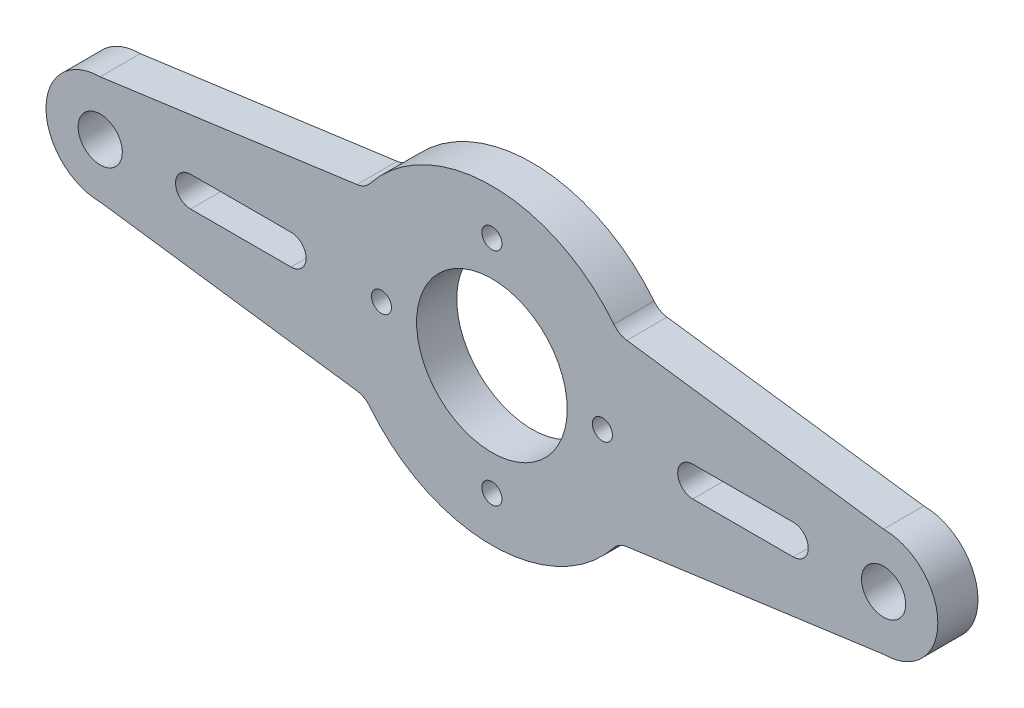
from build123d import *

# Parameters (mm, degrees)
SKETCH1_R             = 1.1
SKETCH1_R_2           = 3.75
BOSS_EXTRUDE1_DEPTH   = 2
F_1_0MM_DOWEL_HOLE1_D = 1
FILLET1_R             = 1


with BuildPart() as part:
    # Sketch1 → Boss-Extrude1 (new body)
    with BuildSketch(Plane.XY):
        with BuildLine():
            Line((-19.5, 2.7), (-6.306155873, 4.504985917))
            ThreePointArc((-6.306155873, 4.504985917), (0, 7.75), (6.306155873, 4.504985917))
            Line((6.306155873, 4.504985917), (19.5, 2.7))
            ThreePointArc((19.5, 2.7), (22.2, 0), (19.5, -2.7))
            Line((19.5, -2.7), (6.306155873, -4.504985917))
            ThreePointArc((6.306155873, -4.504985917), (0, -7.75), (-6.306155873, -4.504985917))
            Line((-6.306155873, -4.504985917), (-19.5, -2.7))
            ThreePointArc((-19.5, -2.7), (-22.2, 0), (-19.5, 2.7))
        make_face()
        with Locations((-19.5, 0)):
            Circle(SKETCH1_R, mode=Mode.SUBTRACT)
        with Locations(Location((19.5, 0, 0), (0, 0, 180))):
            Circle(SKETCH1_R, mode=Mode.SUBTRACT)
        Circle(SKETCH1_R_2, mode=Mode.SUBTRACT)
        with BuildLine():
            Line((-10, -0.75), (-15, -0.75))
            ThreePointArc((-15, -0.75), (-15.75, 0), (-15, 0.75))
            Line((-15, 0.75), (-10, 0.75))
            ThreePointArc((-10, 0.75), (-9.25, 0), (-10, -0.75))
        make_face(mode=Mode.SUBTRACT)
        with BuildLine():
            Line((10, -0.75), (15, -0.75))
            ThreePointArc((15, -0.75), (15.75, 0), (15, 0.75))
            Line((15, 0.75), (10, 0.75))
            ThreePointArc((10, 0.75), (9.25, 0), (10, -0.75))
        make_face(mode=Mode.SUBTRACT)
    extrude(amount=BOSS_EXTRUDE1_DEPTH)

    # Ø1.0mm Dowel Hole1 (through all)
    with Locations(Plane.XY.offset(2)):
        with Locations((-5.5, 0), (0, 5.5), (5.5, 0), (0, -5.5)):
            Hole(F_1_0MM_DOWEL_HOLE1_D / 2)

    # Fillet1
    fillet1_edges = [part.edges().sort_by_distance(p)[0] for p in [
        (-6.306155873, 4.504985917, 1),
        (6.306155873, 4.504985917, 1),
        (6.306155873, -4.504985917, 1),
        (-6.306155873, -4.504985917, 1),
    ]]
    fillet(fillet1_edges, radius=FILLET1_R)


solid = part.part
